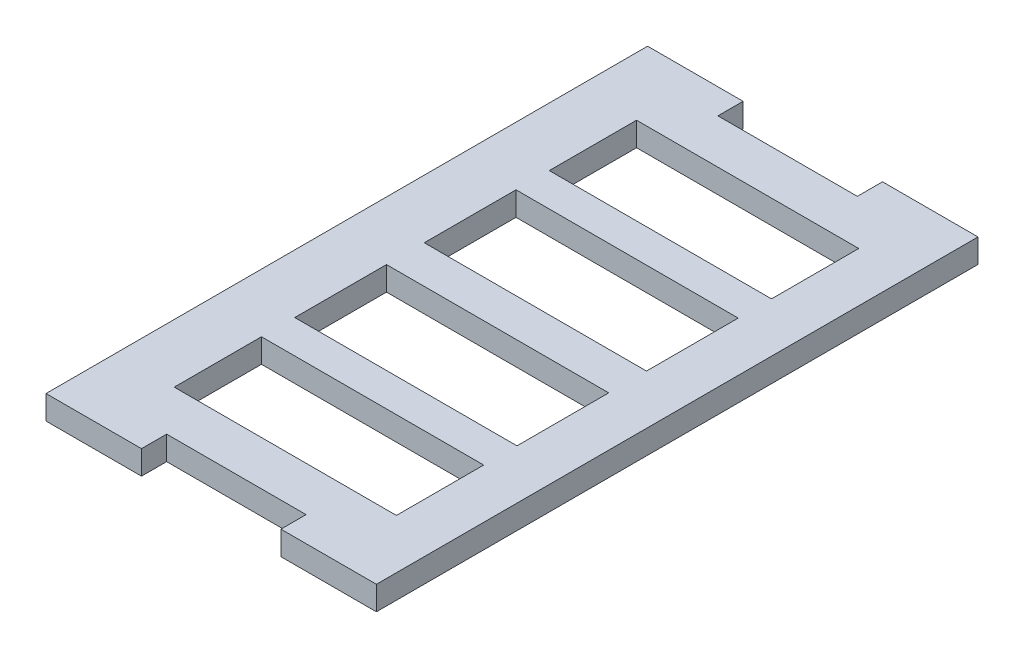
from build123d import *

# Parameters (mm, degrees)
SKETCH1_W           = 46.539672572
SKETCH1_H           = 19.211338676
SKETCH1_H_2         = 18.276713521
SKETCH1_H_3         = 18.27671352
BOSS_EXTRUDE1_DEPTH = 5


with BuildPart() as part:
    # Sketch1 → Boss-Extrude1 (new body)
    with BuildSketch(Plane(origin=(0, 0, 0), x_dir=(1, 0, 0), z_dir=(0, 1, 0))):
        Polygon((-14.77881137, 25.162411855), (14.42118863, 25.162411855), (14.42118863, 30.433230433), (34.42118863, 30.433230433), (34.42118863, 25.433230433), (34.42118863, -90.566769567), (34.42118863, -95.566769567), (14.42118863, -95.566769567), (14.42118863, -90.29595099), (-14.77881137, -90.29595099), (-14.77881137, -95.566769567), (-34.77881137, -95.566769567), (-34.77881137, -90.566769567), (-34.77881137, 25.433230433), (-34.77881137, 30.433230433), (-14.77881137, 30.433230433), align=None)
        with Locations((0.760939105, -46.129253173)):
            Rectangle(SKETCH1_W, SKETCH1_H, mode=Mode.SUBTRACT)
        with Locations((0.760939105, 6.711270036)):
            Rectangle(SKETCH1_W, SKETCH1_H_2, mode=Mode.SUBTRACT)
        with Locations((0.760939105, -19.004285962)):
            Rectangle(SKETCH1_W, SKETCH1_H, mode=Mode.SUBTRACT)
        with Locations((0.760939105, -71.84480917)):
            Rectangle(SKETCH1_W, SKETCH1_H_3, mode=Mode.SUBTRACT)
    extrude(amount=BOSS_EXTRUDE1_DEPTH)


solid = part.part
